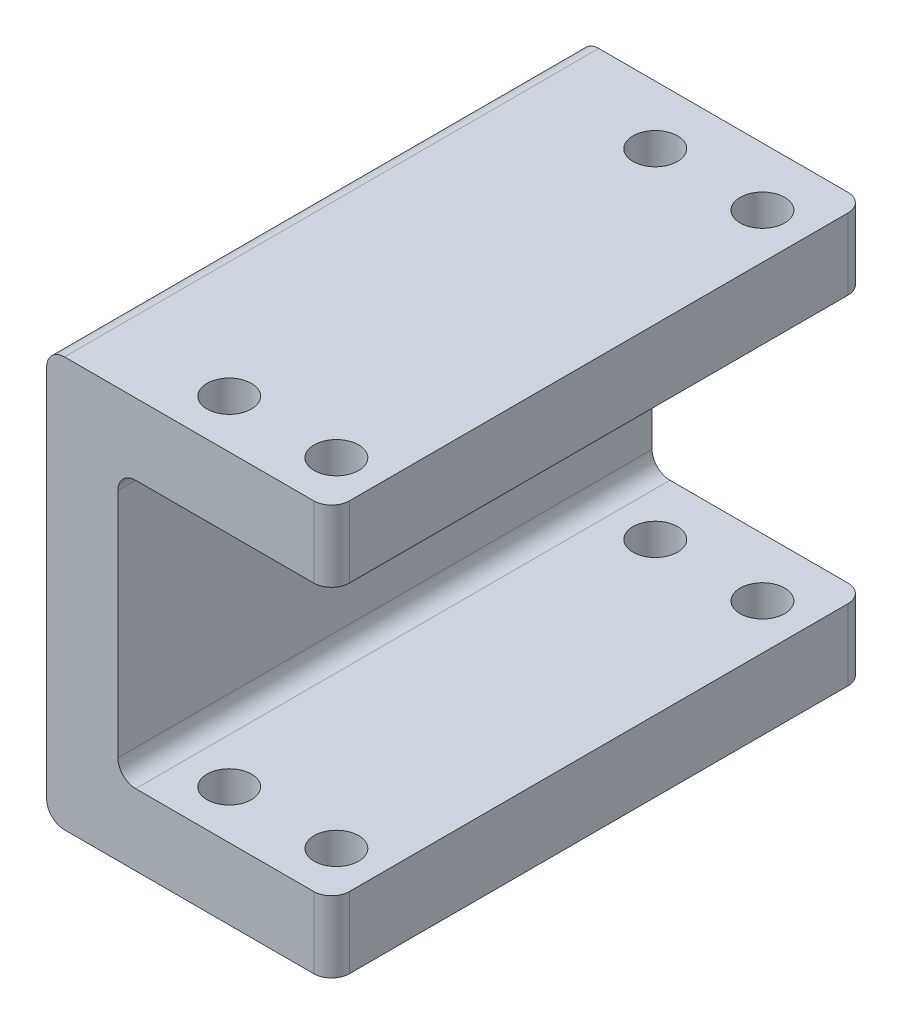
from build123d import *

# Parameters (mm, degrees)
SHEET_EXTRUDE_1_1_DEPTH = 30
THICKEN_1_T2            = 4
CUT_EXTRUDE_1_DEPTH     = 30
FILLET_1_R              = 1
FILLET_2_R              = 1


with BuildPart() as body_1:
    # Sheet Extrude 1: a surface, the sketch's curves swept straight by 30 mm
    with BuildLine(Plane.XY, mode=Mode.PRIVATE) as sheet_extrude_1_1_path:
        Line((12, 15), (0, 15))
        Line((0, 15), (0, 0))
        Line((0, 0), (12, 0))
    sheet_extrude_1_1 = Shell.extrude(sheet_extrude_1_1_path.wire(), (0 * SHEET_EXTRUDE_1_1_DEPTH, 0 * SHEET_EXTRUDE_1_1_DEPTH, 1 * SHEET_EXTRUDE_1_1_DEPTH))
    add(Solid.thicken(sheet_extrude_1_1, -THICKEN_1_T2))

    # 草图2 → 切除-拉伸1 (cut)
    with BuildSketch(Plane(origin=(0, 19, 0), x_dir=(1, 0, 0), z_dir=(0, 1, 0))):
        with BuildLine():
            ThreePointArc((3.46625552, -4.537501621), (4.712321266, -3.283579711), (3.458399356, -2.037513964))
            ThreePointArc((3.458399356, -2.037513964), (2.21233361, -3.291435874), (3.46625552, -4.537501621))
        make_face()
        with BuildLine():
            ThreePointArc((9.466225894, -4.518646828), (10.712291641, -3.264724918), (9.458369731, -2.018659172))
            ThreePointArc((9.458369731, -2.018659172), (8.212303985, -3.272581082), (9.466225894, -4.518646828))
        make_face()
        with BuildLine():
            ThreePointArc((3.541674691, -28.537383119), (4.787740437, -27.283461209), (3.533818527, -26.037395463))
            ThreePointArc((3.533818527, -26.037395463), (2.287752781, -27.291317373), (3.541674691, -28.537383119))
        make_face()
        with BuildLine():
            ThreePointArc((9.541645066, -28.518528326), (10.787710812, -27.264606416), (9.533788902, -26.01854067))
            ThreePointArc((9.533788902, -26.01854067), (8.287723156, -27.27246258), (9.541645066, -28.518528326))
        make_face()
    extrude(amount=-CUT_EXTRUDE_1_DEPTH, mode=Mode.SUBTRACT)

    # 圆角1
    fillet_1_edges = [body_1.edges().sort_by_distance(p)[0] for p in [
        (12, -2, 30),
        (12, 17, 30),
        (12, 17, 0),
        (12, -2, 0),
        (0, 15, 15),
        (0, 0, 15),
    ]]
    fillet(fillet_1_edges, radius=FILLET_1_R)

    # 圆角2
    fillet_2_edges = [body_1.edges().sort_by_distance(p)[0] for p in [
        (-4, -4, 15),
        (-4, 19, 15),
    ]]
    fillet(fillet_2_edges, radius=FILLET_2_R)


solid = body_1.part
